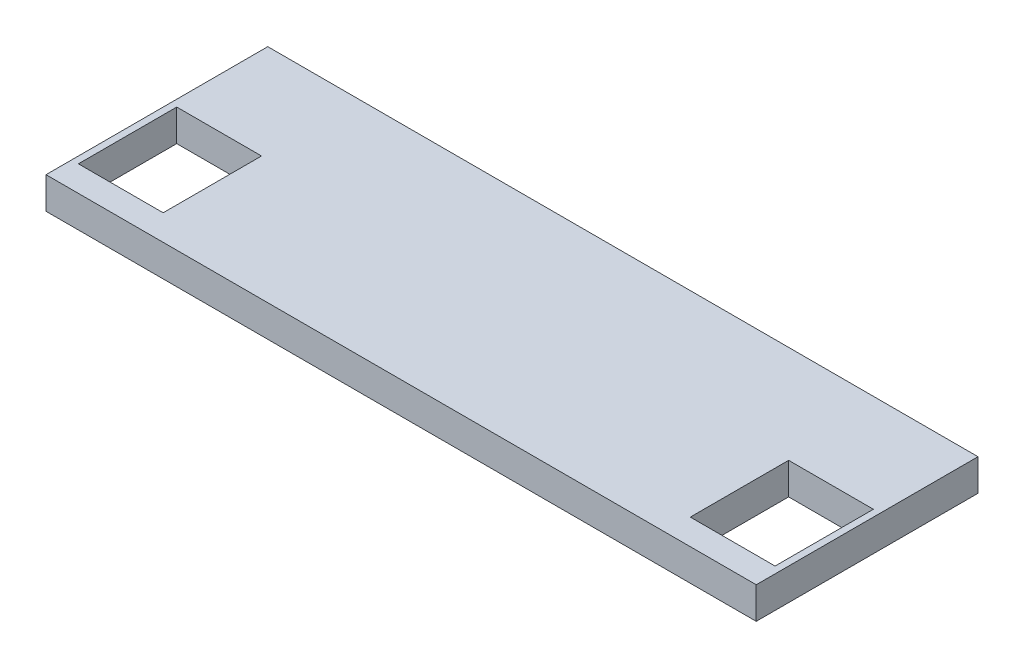
from build123d import *

# Parameters (mm, degrees)
SKETCH1_W           = 53.2003
SKETCH1_H           = 16.6116
SKETCH1_W_2         = 6.35
SKETCH1_H_2         = 7.366
BOSS_EXTRUDE1_DEPTH = 2.3749


with BuildPart() as part:
    # Sketch1 → Boss-Extrude1 (new body)
    with BuildSketch(Plane(origin=(0, 0, 0), x_dir=(1, 0, 0), z_dir=(0, 1, 0))):
        with Locations((0, 8.3058)):
            Rectangle(SKETCH1_W, SKETCH1_H)
        with Locations((22.91715, 5.60197)):
            Rectangle(SKETCH1_W_2, SKETCH1_H_2, mode=Mode.SUBTRACT)
        with Locations((-22.91715, 5.60197)):
            Rectangle(SKETCH1_W_2, SKETCH1_H_2, mode=Mode.SUBTRACT)
    extrude(amount=BOSS_EXTRUDE1_DEPTH)


solid = part.part
